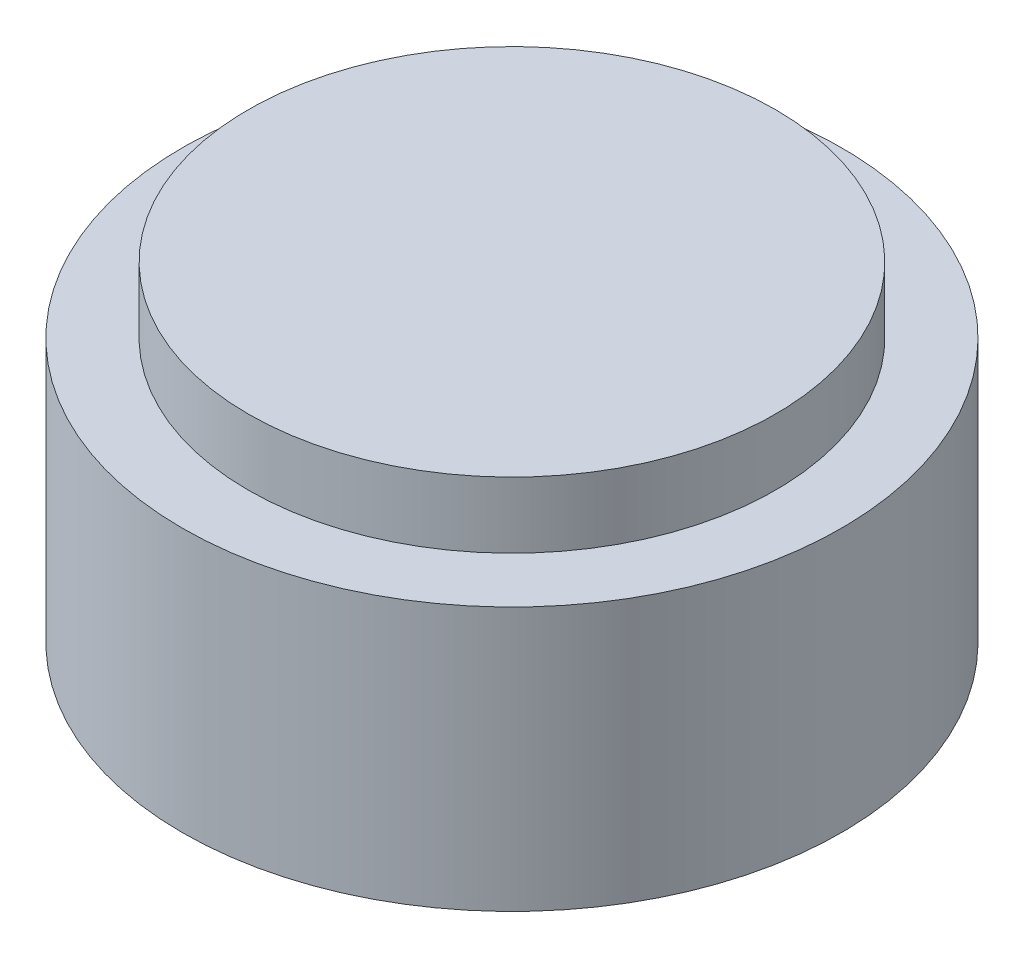
from build123d import *

# Parameters (mm, degrees)
SKETCH1_R           = 15
BOSS_EXTRUDE1_DEPTH = 12
SKETCH2_R           = 12
BOSS_EXTRUDE2_DEPTH = 3


with BuildPart() as part:
    # Sketch1 → Boss-Extrude1 (new body)
    with BuildSketch(Plane(origin=(0, 0, 0), x_dir=(1, 0, 0), z_dir=(0, 1, 0))):
        with Locations(Location((0, 0, 0), (0, 0, 270))):
            Circle(SKETCH1_R)
        with BuildLine():
            Line((-0.965663189, 3.050818678), (2.836784234, 1.480761699))
            ThreePointArc((2.836784234, 1.480761699), (-1.221287526, -2.957779028), (-0.965663189, 3.050818678))
        make_face(mode=Mode.SUBTRACT)
    extrude(amount=BOSS_EXTRUDE1_DEPTH)

    # Sketch2 → Boss-Extrude2 (add)
    with BuildSketch(Plane(origin=(0, 12, 0), x_dir=(1, 0, 0), z_dir=(0, 1, 0))):
        with Locations(Location((0, 0, 0), (0, 0, 270))):
            Circle(SKETCH2_R)
    extrude(amount=BOSS_EXTRUDE2_DEPTH)


solid = part.part
